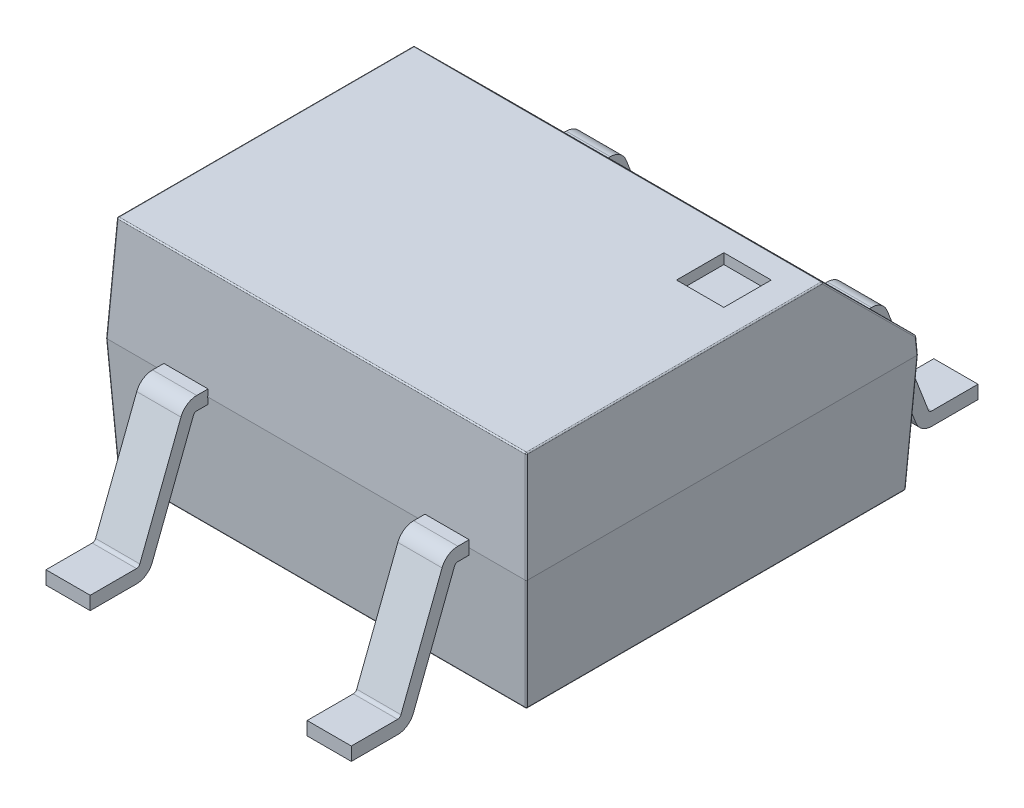
from build123d import *

# Parameters (mm, degrees)
SKETCH1_W                 = 4.09
SKETCH1_H                 = 3.81
EXTRUDE1_DEPTH            = 1.02
EXTRUDE1_TAPER            = 3
EXTRUDE1_OTHER_WAY_DEPTH  = 1.14
EXTRUDE1_OTHER_WAY_TAPER  = 3
FILLET1_R                 = 0.0125
SKETCH4_W                 = 0.43
SKETCH4_H                 = 0.13
ESPELHAR2_COPY_1_SKETCH_W = 0.43
ESPELHAR2_COPY_1_SKETCH_H = 0.13
CORTE_EXTRUS_O1_DEPTH     = 5
FILETE2_R                 = 0.0125
ESBO_O2_W                 = 0.46080031
ESBO_O2_H                 = 0.460800311
CORTE_EXTRUS_O2_DEPTH     = 0.1


with BuildPart() as part:
    # Sketch1 → Extrude1 (new body)
    with BuildSketch(Plane(origin=(0, 0, 0), x_dir=(1, 0, 0), z_dir=(0, 1, 0))):
        Rectangle(SKETCH1_W, SKETCH1_H)
    extrude(amount=EXTRUDE1_DEPTH, taper=EXTRUDE1_TAPER)

    # Sketch1 → Extrude1 other way (add)
    with BuildSketch(Plane(origin=(0, 0, 0), x_dir=(1, 0, 0), z_dir=(0, 1, 0))):
        Rectangle(SKETCH1_W, SKETCH1_H)
    extrude(amount=-EXTRUDE1_OTHER_WAY_DEPTH, taper=EXTRUDE1_OTHER_WAY_TAPER)

    # Fillet1
    fillet1_edges = [part.edges().sort_by_distance(p)[0] for p in [
        (1.985255132, -1.14, 0),
        (-2.018272033, 0.51, -1.878272033),
        (0, -1.14, -1.845255132),
        (-2.018272033, 0.51, 1.878272033),
        (2.018272033, 0.51, 1.878272033),
        (2.018272033, 0.51, -1.878272033),
        (-1.991544065, 1.02, 0),
        (0, 1.02, 1.851544065),
        (1.991544065, 1.02, 0),
        (0, 1.02, -1.851544065),
        (-1.985255132, -1.14, 0),
        (0, -1.14, 1.845255132),
        (-2.015127566, -0.57, -1.875127566),
        (2.015127566, -0.57, -1.875127566),
        (2.015127566, -0.57, 1.875127566),
        (-2.015127566, -0.57, 1.875127566),
    ]]
    fillet(fillet1_edges, radius=FILLET1_R)

    # Sweep2: sweep along a path in Sketch3
    with BuildLine(Plane(origin=(1.27, 0, 0), x_dir=(0, 0, -1), z_dir=(1, 0, 0))) as sweep2_path:
        Line((-1.9, 0), (-2.011557331, 0))
        ThreePointArc((-2.011557331, 0), (-2.068130739, -0.017541225), (-2.104856809, -0.064011009))
        Line((-2.104856809, -0.064011009), (-2.504856809, -1.100988991))
        ThreePointArc((-2.504856809, -1.100988991), (-2.541582879, -1.147458775), (-2.598156286, -1.165))
        Line((-2.598156286, -1.165), (-3.048, -1.165))
    # Sketch4 → Sweep2 (sweep)
    with BuildSketch(Plane.XY.offset(3.048)):
        with Locations((1.27, -1.165)):
            Rectangle(SKETCH4_W, SKETCH4_H)
    sweep2 = sweep(path=sweep2_path.line)

    # Espelhar1: Sweep2 across plane
    add(sweep2.mirror(Plane(origin=(0, 0, 0), x_dir=(0, 0, 1), z_dir=(1, 0, 0))))

    # Espelhar2: Sweep2 across plane
    add(sweep2.mirror(Plane.XY))

    # Espelhar2 copy 1: sweep along a path in Espelhar2 copy 1 path
    with BuildLine(Plane.ZY.offset(1.27)) as espelhar2_copy_1_path:
        Line((-1.9, 0), (-2.011557331, 0))
        ThreePointArc((-2.011557331, 0), (-2.068130739, -0.017541225), (-2.104856809, -0.064011009))
        Line((-2.104856809, -0.064011009), (-2.504856809, -1.100988991))
        ThreePointArc((-2.504856809, -1.100988991), (-2.541582879, -1.147458775), (-2.598156286, -1.165))
        Line((-2.598156286, -1.165), (-3.048, -1.165))
    # Espelhar2 copy 1 sketch → Espelhar2 copy 1 (sweep)
    with BuildSketch(Plane(origin=(0, 0, -3.048), x_dir=(-1, 0, 0), z_dir=(0, 0, -1))):
        with Locations((1.27, -1.165)):
            Rectangle(ESPELHAR2_COPY_1_SKETCH_W, ESPELHAR2_COPY_1_SKETCH_H)
    sweep(path=espelhar2_copy_1_path.line)

    # Esboço1 → Corte-extrusão1 (cut, symmetric)
    with BuildSketch(Plane(origin=(0, 0, 0), x_dir=(0, 0, -1), z_dir=(1, 0, 0))):
        Polygon((1.944363766, 0.112158767), (0.911535483, 1.139690495), (1.944363766, 1.139690495), align=None)
    extrude(amount=CORTE_EXTRUS_O1_DEPTH, both=True, mode=Mode.SUBTRACT)

    # Filete2
    filete2_edges = [part.edges().sort_by_distance(p)[0] for p in [
        (2.033539448, 0.164416621, -1.891836541),
        (-1.988984952, 1.015848966, -1.03601537),
        (0, 1.02, -1.031842939),
        (1.988984952, 1.015848967, -1.036015369),
        (-2.033539449, 0.164416622, -1.891836541),
        (-2.014055812, 0.590450273, -1.463606839),
        (0, 0.159644369, -1.896633393),
        (2.014055796, 0.590450579, -1.463606532),
    ]]
    fillet(filete2_edges, radius=FILETE2_R)

    # Esboço2 → Corte-extrusão2 (cut)
    with BuildSketch(Plane(origin=(0, 1.02, 0), x_dir=(1, 0, 0), z_dir=(0, 1, 0))):
        with Locations((1.491508288, 0.569379695)):
            Rectangle(ESBO_O2_W, ESBO_O2_H)
    extrude(amount=-CORTE_EXTRUS_O2_DEPTH, mode=Mode.SUBTRACT)


solid = part.part
